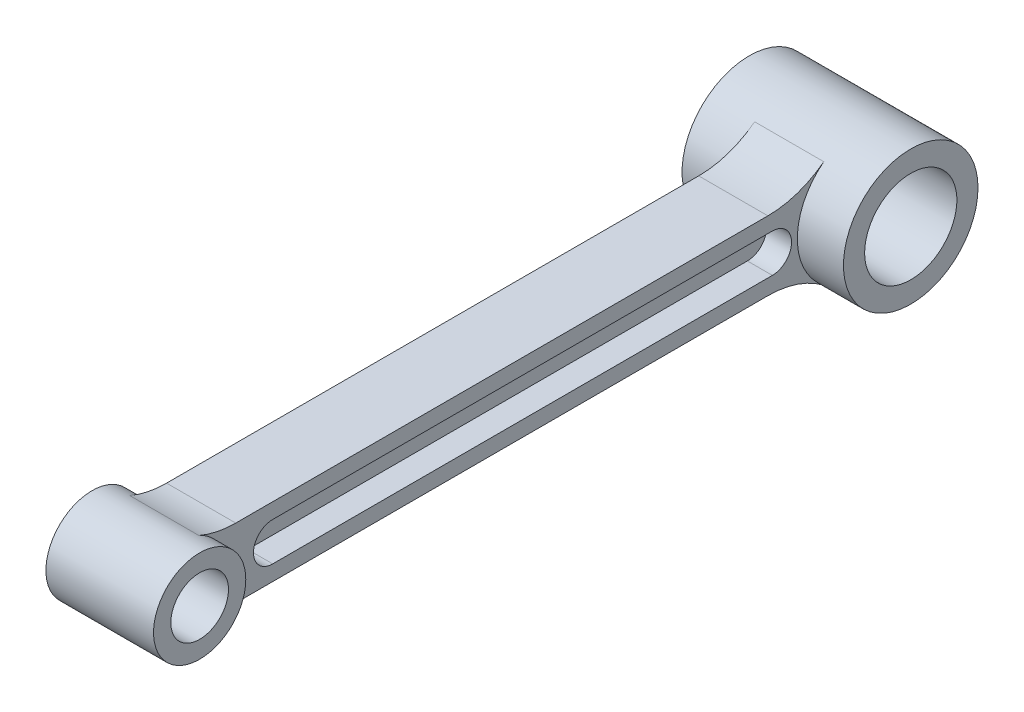
from build123d import *

# Parameters (mm, degrees)
BOSS_EXTRUDE1_DEPTH = 2.5
SKETCH1_3_R         = 12.000000000000005
BOSS_EXTRUDE2_DEPTH = 21
SKETCH1_4_R         = 7.499999999999999
BOSS_EXTRUDE3_DEPTH = 14
BOSS_EXTRUDE4_DEPTH = 9


with BuildPart() as part:
    # Sketch1 → Boss-Extrude1 (new, symmetric)
    with BuildSketch(Plane(origin=(0, 0, 0), x_dir=(0, 0, -1), z_dir=(1, 0, 0))):
        with BuildLine():
            Line((130, 5), (0, 5))
            ThreePointArc((0, 5), (-5, 3.1e-16), (-6.1e-16, -5))
            Line((0, -5), (130, -5))
            ThreePointArc((130, -5), (135, 1.4e-16), (130, 5))
        make_face()
    extrude(amount=BOSS_EXTRUDE1_DEPTH, both=True)



with BuildPart() as body_2:
    # Sketch1<3> → Boss-Extrude2 (new, symmetric)
    with BuildSketch(Plane(origin=(0, 0, 0), x_dir=(0, 0, -1), z_dir=(1, 0, 0))):
        with BuildLine():
            ThreePointArc((143.38848111745406, 13.91566265060244), (136.49999999999997, 2.14e-15), (143.38848111745406, -13.915662650602442))
            ThreePointArc((143.38848111745406, -13.915662650602442), (161.76364668037664, -15.683615342843545), (171.50000000000003, -4.29e-15))
            ThreePointArc((171.50000000000003, 0), (161.76364668037664, 15.683615342843545), (143.38848111745406, 13.91566265060244))
        make_face()
        with Locations((154, 0)):
            Circle(SKETCH1_3_R, mode=Mode.SUBTRACT)
    extrude(amount=BOSS_EXTRUDE2_DEPTH, both=True)


with BuildPart() as body_3:
    # Sketch1<4> → Boss-Extrude3 (new, symmetric)
    with BuildSketch(Plane(origin=(0, 0, 0), x_dir=(0, 0, -1), z_dir=(1, 0, 0))):
        with BuildLine():
            ThreePointArc((-19.20416847668728, 10.999999999999996), (-36, 1.47e-15), (-19.204168476687283, -10.999999999999998))
            ThreePointArc((-19.204168476687283, -10.999999999999998), (-13.961325329513054, -6.574573055349202), (-12.000000000000004, -2.94e-15))
            ThreePointArc((-12.000000000000004, 0), (-13.96132532951305, 6.574573055349195), (-19.20416847668728, 10.999999999999996))
        make_face()
        with Locations((-24, 0)):
            Circle(SKETCH1_4_R, mode=Mode.SUBTRACT)
    extrude(amount=BOSS_EXTRUDE3_DEPTH, both=True)


with BuildPart() as part_1:
    add(part.part)

    add(body_2.part)  # Boss-Extrude4 merges body 2

    add(body_3.part)  # Boss-Extrude4 merges body 3
    # Sketch1<5> → Boss-Extrude4 (add, symmetric)
    with BuildSketch(Plane(origin=(0, 0, 0), x_dir=(0, 0, -1), z_dir=(1, 0, 0))):
        with BuildLine():
            ThreePointArc((-19.20416847668728, -11), (-14.511484915628193, -9.50531975105854), (-9.612505430061832, -9))
            Line((-9.612505430061834, -8.999999999999998), (128.83554093567676, -8.999999999999998))
            ThreePointArc((128.83554093567676, -9.000000000000007), (136.51590237295488, -10.262101060283292), (143.38848111745406, -13.915662650602439))
            ThreePointArc((143.38848111745406, -13.915662650602442), (136.49999999999997, 2.14e-15), (143.38848111745406, 13.91566265060244))
            ThreePointArc((143.38848111745406, 13.915662650602439), (136.51590237295488, 10.262101060283292), (128.83554093567676, 9.000000000000007))
            Line((128.83554093567676, 9.000000000000005), (-9.612505430061834, 9.000000000000002))
            ThreePointArc((-9.612505430061834, 9), (-14.511484915628195, 9.505319751058536), (-19.20416847668728, 10.999999999999996))
            ThreePointArc((-19.20416847668728, 10.999999999999996), (-13.96132532951305, 6.574573055349195), (-12.000000000000004, 0))
            ThreePointArc((-12.000000000000004, -2.94e-15), (-13.961325329513054, -6.574573055349202), (-19.204168476687283, -10.999999999999998))
        make_face()
        with BuildLine():
            ThreePointArc((-6.1e-16, -5), (-5, 3.1e-16), (0, 5))
            Line((0, 5), (130, 5))
            ThreePointArc((130, 5), (135, 1.4e-16), (130, -5))
            Line((130, -5), (0, -5))
        make_face(mode=Mode.SUBTRACT)
    extrude(amount=BOSS_EXTRUDE4_DEPTH, both=True)


solid = part_1.part
